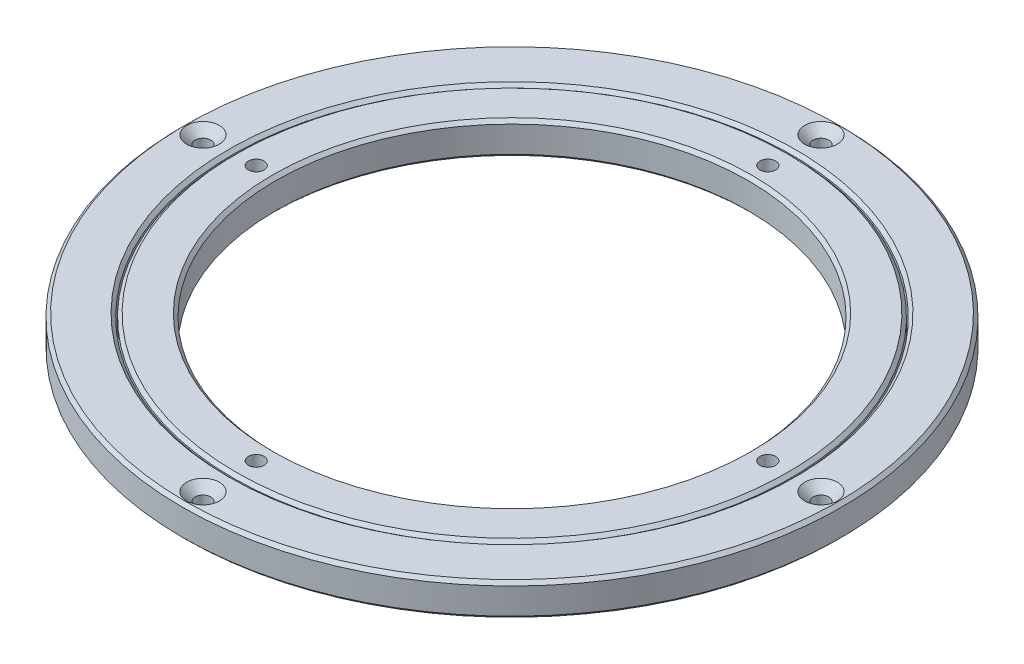
from build123d import *

# Parameters (mm, degrees)
SKETCH1_R                                      = 100.975
SKETCH1_R_2                                    = 85.875
BOSS_EXTRUDE1_DEPTH                            = 10
SKETCH1_R_3                                    = 85.475
SKETCH1_R_4                                    = 72.375
BOSS_EXTRUDE1_2_DEPTH                          = 10
CHAMFER1_SIZE                                  = 1
CHAMFER2_SIZE                                  = 1
CSK_FOR_M4_FLAT_HEAD_MACHINE_SCREW1_AT_2_COUNT = 2
CSK_FOR_M4_FLAT_HEAD_MACHINE_SCREW1_AT_2_PITCH = 133.890669018
CSK_FOR_M4_FLAT_HEAD_MACHINE_SCREW1_AT_3_COUNT = 2
CSK_FOR_M4_FLAT_HEAD_MACHINE_SCREW1_AT_3_PITCH = 189.35
CSK_FOR_M4_FLAT_HEAD_MACHINE_SCREW1_AT_4_COUNT = 2
CSK_FOR_M4_FLAT_HEAD_MACHINE_SCREW1_AT_4_PITCH = 133.890669018
CSK_FOR_M4_FLAT_HEAD_MACHINE_SCREW2_AT_2_COUNT = 2
CSK_FOR_M4_FLAT_HEAD_MACHINE_SCREW2_AT_2_PITCH = 110.838987951
CSK_FOR_M4_FLAT_HEAD_MACHINE_SCREW2_AT_3_COUNT = 2
CSK_FOR_M4_FLAT_HEAD_MACHINE_SCREW2_AT_3_PITCH = 156.75
CSK_FOR_M4_FLAT_HEAD_MACHINE_SCREW2_AT_4_COUNT = 2
CSK_FOR_M4_FLAT_HEAD_MACHINE_SCREW2_AT_4_PITCH = 110.838987951


with BuildPart() as part:
    # Sketch1 → Boss-Extrude1 (new body)
    with BuildSketch(Plane(origin=(0, 0, 0), x_dir=(1, 0, 0), z_dir=(0, 1, 0))):
        with Locations(Location((0, 0, 0), (0, 0, 270))):
            Circle(SKETCH1_R)
        with Locations(Location((0, 0, 0), (0, 0, 270))):
            Circle(SKETCH1_R_2, mode=Mode.SUBTRACT)
    extrude(amount=BOSS_EXTRUDE1_DEPTH)

    # Chamfer2
    chamfer2_edges = [part.edges().sort_by_distance(p)[0] for p in [
        (0, 10, -100.975),
        (0, 0, -100.975),
        (0, 0, -85.875),
        (0, 10, -85.875),
    ]]
    chamfer(chamfer2_edges, length=CHAMFER2_SIZE)

    # Sketch4 → CSK for M4 Flat Head Machine Screw1 (revolve, cut)
    with BuildSketch(Plane(origin=(94.675, 10, 0), x_dir=(0, 0, 1), z_dir=(1, 0, 0))):
        Polygon((0, 0), (0, 10), (2.4, 10), (2.4, 2.6), (5, 0), align=None)
    csk_for_m4_flat_head_machine_screw1 = revolve(axis=Axis((94.675, 16.35, 0), (0, -1, 0)), mode=Mode.SUBTRACT)

    # CSK for M4 Flat Head Machine Screw1 at 2: CSK for M4 Flat Head Machine Screw1 ×2
    with Locations(*[Vector(-0.7071067811865475, 0, 0.7071067811865476) * (i * CSK_FOR_M4_FLAT_HEAD_MACHINE_SCREW1_AT_2_PITCH) for i in range(1, CSK_FOR_M4_FLAT_HEAD_MACHINE_SCREW1_AT_2_COUNT)]):
        add(csk_for_m4_flat_head_machine_screw1, mode=Mode.SUBTRACT)

    # CSK for M4 Flat Head Machine Screw1 at 3: CSK for M4 Flat Head Machine Screw1 ×2
    with Locations(*[(-i * CSK_FOR_M4_FLAT_HEAD_MACHINE_SCREW1_AT_3_PITCH, 0, 0) for i in range(1, CSK_FOR_M4_FLAT_HEAD_MACHINE_SCREW1_AT_3_COUNT)]):
        add(csk_for_m4_flat_head_machine_screw1, mode=Mode.SUBTRACT)

    # CSK for M4 Flat Head Machine Screw1 at 4: CSK for M4 Flat Head Machine Screw1 ×2
    with Locations(*[Vector(-0.7071067811865475, 0, -0.7071067811865476) * (i * CSK_FOR_M4_FLAT_HEAD_MACHINE_SCREW1_AT_4_PITCH) for i in range(1, CSK_FOR_M4_FLAT_HEAD_MACHINE_SCREW1_AT_4_COUNT)]):
        add(csk_for_m4_flat_head_machine_screw1, mode=Mode.SUBTRACT)


with BuildPart() as body_2:
    # Sketch1 → Boss-Extrude1 2 (new body)
    with BuildSketch(Plane(origin=(0, 0, 0), x_dir=(1, 0, 0), z_dir=(0, 1, 0))):
        with Locations(Location((0, 0, 0), (0, 0, 270))):
            Circle(SKETCH1_R_3)
        with Locations(Location((0, 0, 0), (0, 0, 270))):
            Circle(SKETCH1_R_4, mode=Mode.SUBTRACT)
    extrude(amount=BOSS_EXTRUDE1_2_DEPTH)

    # Chamfer1
    chamfer1_edges = [body_2.edges().sort_by_distance(p)[0] for p in [
        (0, 10, -85.475),
        (0, 0, -72.375),
        (0, 10, -72.375),
    ]]
    chamfer(chamfer1_edges, length=CHAMFER1_SIZE)

    # Sketch6 → CSK for M4 Flat Head Machine Screw2 (revolve, cut)
    with BuildSketch(Plane(origin=(0, 0, 78.375), x_dir=(0, 0, -1), z_dir=(1, 0, 0))):
        Polygon((0, 0), (0, 10), (2.4, 10), (2.4, 2.6), (5, 0), align=None)
    csk_for_m4_flat_head_machine_screw2 = revolve(axis=Axis((0, -6.35, 78.375), (0, 1, 0)), mode=Mode.SUBTRACT)

    # CSK for M4 Flat Head Machine Screw2 at 2: CSK for M4 Flat Head Machine Screw2 ×2
    with Locations(*[Vector(0.7071067811865476, 0, -0.7071067811865476) * (i * CSK_FOR_M4_FLAT_HEAD_MACHINE_SCREW2_AT_2_PITCH) for i in range(1, CSK_FOR_M4_FLAT_HEAD_MACHINE_SCREW2_AT_2_COUNT)]):
        add(csk_for_m4_flat_head_machine_screw2, mode=Mode.SUBTRACT)

    # CSK for M4 Flat Head Machine Screw2 at 3: CSK for M4 Flat Head Machine Screw2 ×2
    with Locations(*[(0, 0, -i * CSK_FOR_M4_FLAT_HEAD_MACHINE_SCREW2_AT_3_PITCH) for i in range(1, CSK_FOR_M4_FLAT_HEAD_MACHINE_SCREW2_AT_3_COUNT)]):
        add(csk_for_m4_flat_head_machine_screw2, mode=Mode.SUBTRACT)

    # CSK for M4 Flat Head Machine Screw2 at 4: CSK for M4 Flat Head Machine Screw2 ×2
    with Locations(*[Vector(-0.7071067811865476, 0, -0.7071067811865476) * (i * CSK_FOR_M4_FLAT_HEAD_MACHINE_SCREW2_AT_4_PITCH) for i in range(1, CSK_FOR_M4_FLAT_HEAD_MACHINE_SCREW2_AT_4_COUNT)]):
        add(csk_for_m4_flat_head_machine_screw2, mode=Mode.SUBTRACT)


solid = Compound([part.part, body_2.part])
